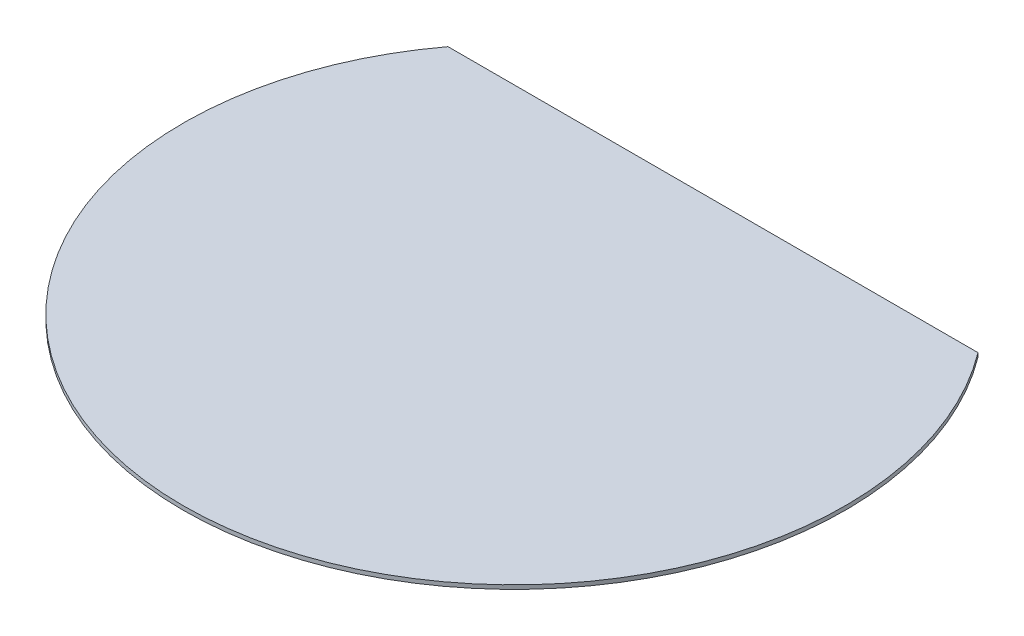
from build123d import *

# Parameters (mm, degrees)
BOSS_EXTRUDE1_DEPTH = 12.7


with BuildPart() as part:
    # Sketch1 → Boss-Extrude1 (new body)
    with BuildSketch(Plane(origin=(0, 0, 0), x_dir=(1, 0, 0), z_dir=(0, 1, 0))):
        with BuildLine():
            Line((-848.36, 636.27), (848.36, 636.27))
            ThreePointArc((848.36, 636.27), (0, -1060.45), (-848.36, 636.27))
        make_face()
    extrude(amount=BOSS_EXTRUDE1_DEPTH)


solid = part.part
